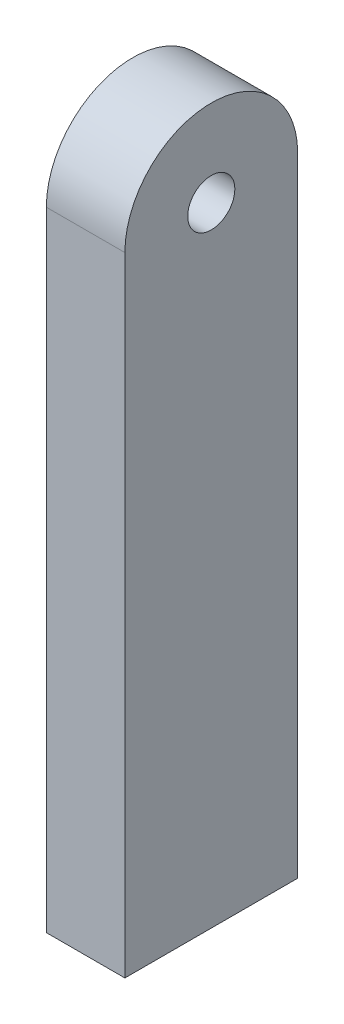
from build123d import *

# Parameters (mm, degrees)
SKETCH1_R               = 1.5
BOSS_EXTRUDE1_DEPTH     = 5
CUT_EXTRUDE1_REACH      = 48.103
CUT_EXTRUDE1_END_RADIUS = 6.5
SKETCH2_R               = 2


with BuildPart() as part:
    # Sketch1 → Boss-Extrude1 (new body)
    with BuildSketch(Plane(origin=(0, 0, 0), x_dir=(0, 0, -1), z_dir=(1, 0, 0))):
        with BuildLine():
            Line((-5.5, 20), (-5.5, -20))
            Line((-5.5, -20), (5.5, -20))
            Line((5.5, -20), (5.5, 20))
            ThreePointArc((5.5, 20), (0, 25.5), (-5.5, 20))
        make_face()
        with Locations((0, 20)):
            Circle(SKETCH1_R, mode=Mode.SUBTRACT)
    extrude(amount=BOSS_EXTRUDE1_DEPTH)

    # Cut-Extrude1: up to this cylinder (the profile starts outside it)
    cut_extrude1_end = Plane(origin=(2.5, 20, 0), z_dir=(-1, 0, 0)) * Cylinder(CUT_EXTRUDE1_END_RADIUS, 110.206, mode=Mode.PRIVATE)
    # Sketch2 → Cut-Extrude1 (cut, up to the surface)
    with BuildSketch(Plane.XZ.offset(20), mode=Mode.PRIVATE) as cut_extrude1_sk1:
        with Locations(Location((2.5, 0, 0), (0, 0, 270))):
            Circle(SKETCH2_R)
    cut_extrude1_tool1 = extrude(cut_extrude1_sk1.sketch, amount=-CUT_EXTRUDE1_REACH, mode=Mode.PRIVATE) - cut_extrude1_end
    add(cut_extrude1_tool1.solids().sort_by_distance((2.5, -20, 0))[0], mode=Mode.SUBTRACT)


solid = part.part
